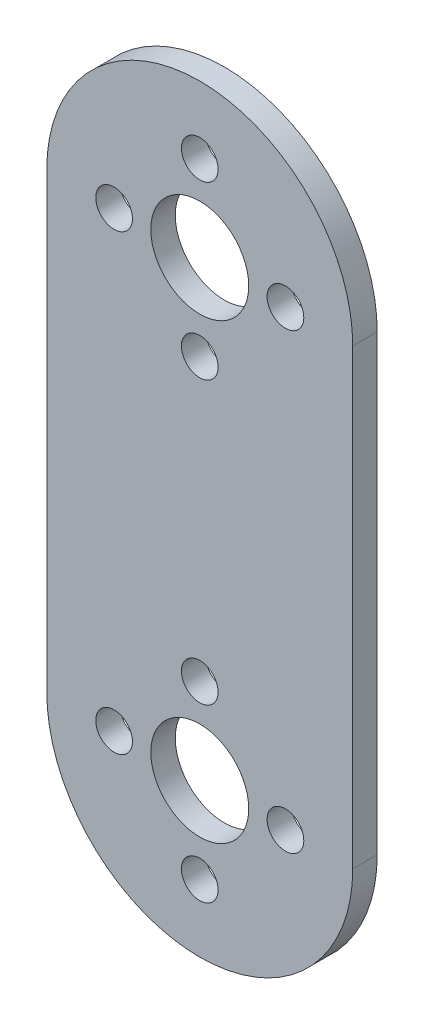
from build123d import *

# Parameters (mm, degrees)
BOSS_EXTRUDE1_DEPTH     = 1
CUT_EXTRUDE1_REACH      = 53.093
SKETCH2_R               = 4
CUT_EXTRUDE2_REACH      = 53.093
SKETCH2_3_R             = 1.5
CIRPATTERN1_COUNT       = 4
MIRROR1_COPY_1_REACH    = 53.093
MIRROR1_COPY_1_SKETCH_R = 1.5
MIRROR1_COPY_2_REACH    = 53.093
MIRROR1_COPY_2_SKETCH_R = 1.5
MIRROR1_COPY_3_REACH    = 53.093
MIRROR1_COPY_3_SKETCH_R = 1.5


with BuildPart() as part:
    # Sketch1 → Boss-Extrude1 (new, symmetric)
    with BuildSketch(Plane.XY):
        with BuildLine():
            Line((-12.5, 0), (-12.5, 37))
            ThreePointArc((-12.5, 37), (0, 49.5), (12.5, 37))
            Line((12.5, 37), (12.5, 0))
            ThreePointArc((12.5, 0), (0, -12.5), (-12.5, 0))
        make_face()
    extrude(amount=BOSS_EXTRUDE1_DEPTH, both=True)

    # Sketch2 → Cut-Extrude1 (cut, up to next)
    with BuildSketch(Plane(origin=(0, 0, -1), x_dir=(-1, 0, 0), z_dir=(0, 0, -1)), mode=Mode.PRIVATE) as cut_extrude1_sk1:
        with Locations((0, 37)):
            Circle(SKETCH2_R)
    cut_extrude1_tool1 = extrude(cut_extrude1_sk1.sketch, amount=-CUT_EXTRUDE1_REACH, mode=Mode.PRIVATE) & part.part
    cut_extrude1 = cut_extrude1_tool1.solids().sort_by_distance((0, 37, -1))[0]
    add(cut_extrude1, mode=Mode.SUBTRACT)

    # Sketch2<3> → Cut-Extrude2 (cut, up to next)
    with BuildSketch(Plane(origin=(0, 0, -1), x_dir=(-1, 0, 0), z_dir=(0, 0, -1)), mode=Mode.PRIVATE) as cut_extrude2_sk1:
        with Locations((0, 44)):
            Circle(SKETCH2_3_R)
    cut_extrude2_tool1 = extrude(cut_extrude2_sk1.sketch, amount=-CUT_EXTRUDE2_REACH, mode=Mode.PRIVATE) & part.part
    cut_extrude2 = cut_extrude2_tool1.solids().sort_by_distance((0, 44, -1))[0]
    add(cut_extrude2, mode=Mode.SUBTRACT)

    # CirPattern1: Cut-Extrude2 ×4 about axis
    cirpattern1_axis = Axis((0, 37, -1), (0, 0, -1))
    for i in range(1, CIRPATTERN1_COUNT):
        add(cut_extrude2.rotate(cirpattern1_axis, i * 360 / CIRPATTERN1_COUNT), mode=Mode.SUBTRACT)

    # Mirror1: Cut-Extrude1, Cut-Extrude2 across plane
    add(cut_extrude1.mirror(Plane.ZX.offset(18.5)), mode=Mode.SUBTRACT)
    add(cut_extrude2.mirror(Plane.ZX.offset(18.5)), mode=Mode.SUBTRACT)

    # Mirror1 copy 1 sketch → Mirror1 copy 1 (cut, up to next)
    with BuildSketch(Plane(origin=(-37, 0, -1), x_dir=(0, -1, 0), z_dir=(0, 0, -1)), mode=Mode.PRIVATE) as mirror1_copy_1_sk1:
        with Locations((0, -44)):
            Circle(MIRROR1_COPY_1_SKETCH_R)
    mirror1_copy_1_tool1 = extrude(mirror1_copy_1_sk1.sketch, amount=-MIRROR1_COPY_1_REACH, mode=Mode.PRIVATE) & part.part
    add(mirror1_copy_1_tool1.solids().sort_by_distance((7, 0, -1))[0], mode=Mode.SUBTRACT)

    # Mirror1 copy 2 sketch → Mirror1 copy 2 (cut, up to next)
    with BuildSketch(Plane(origin=(0, -37, -1), x_dir=(1, 0, 0), z_dir=(0, 0, -1)), mode=Mode.PRIVATE) as mirror1_copy_2_sk1:
        with Locations((0, -44)):
            Circle(MIRROR1_COPY_2_SKETCH_R)
    mirror1_copy_2_tool1 = extrude(mirror1_copy_2_sk1.sketch, amount=-MIRROR1_COPY_2_REACH, mode=Mode.PRIVATE) & part.part
    add(mirror1_copy_2_tool1.solids().sort_by_distance((0, 7, -1))[0], mode=Mode.SUBTRACT)

    # Mirror1 copy 3 sketch → Mirror1 copy 3 (cut, up to next)
    with BuildSketch(Plane(origin=(37, 0, -1), x_dir=(0, 1, 0), z_dir=(0, 0, -1)), mode=Mode.PRIVATE) as mirror1_copy_3_sk1:
        with Locations((0, -44)):
            Circle(MIRROR1_COPY_3_SKETCH_R)
    mirror1_copy_3_tool1 = extrude(mirror1_copy_3_sk1.sketch, amount=-MIRROR1_COPY_3_REACH, mode=Mode.PRIVATE) & part.part
    add(mirror1_copy_3_tool1.solids().sort_by_distance((-7, 0, -1))[0], mode=Mode.SUBTRACT)


solid = part.part
